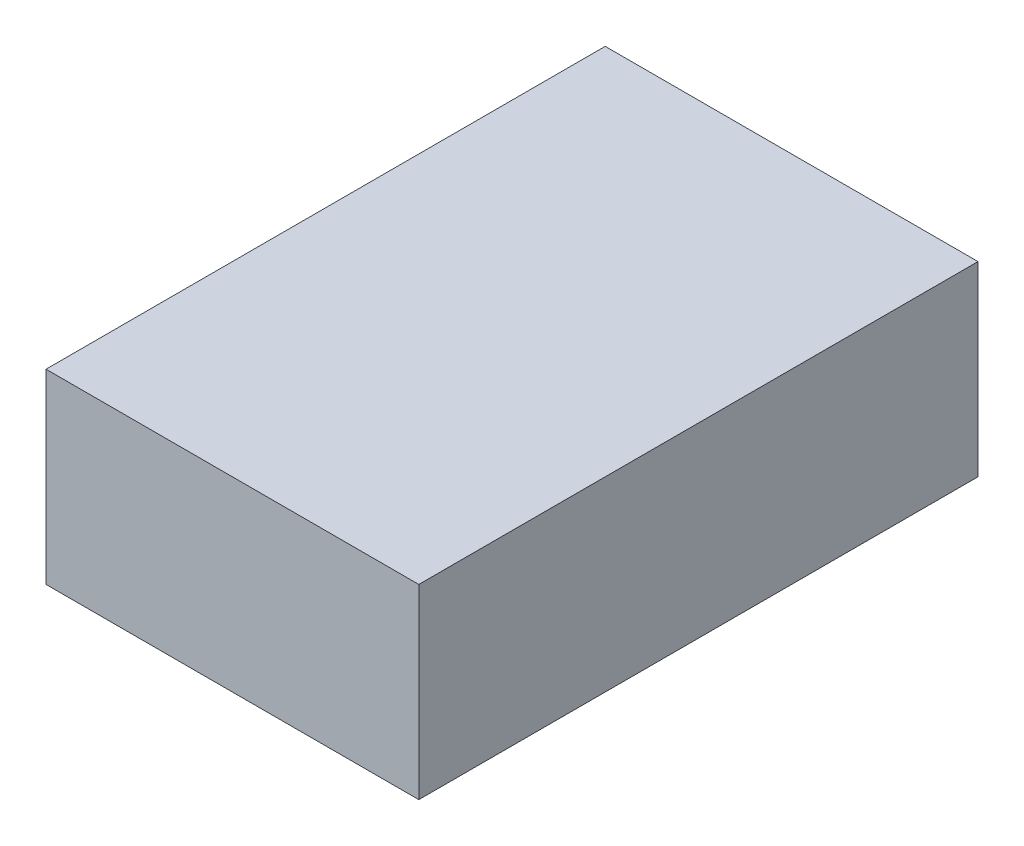
from build123d import *

# Parameters (mm, degrees)
ESQUISSE2_W        = 4
ESQUISSE2_H        = 2
BOSS_EXTRU_1_DEPTH = 6


with BuildPart() as part:
    # Esquisse2 → Boss.-Extru.1 (new body)
    with BuildSketch(Plane.XY):
        Rectangle(ESQUISSE2_W, ESQUISSE2_H)
    extrude(amount=BOSS_EXTRU_1_DEPTH)


solid = part.part
